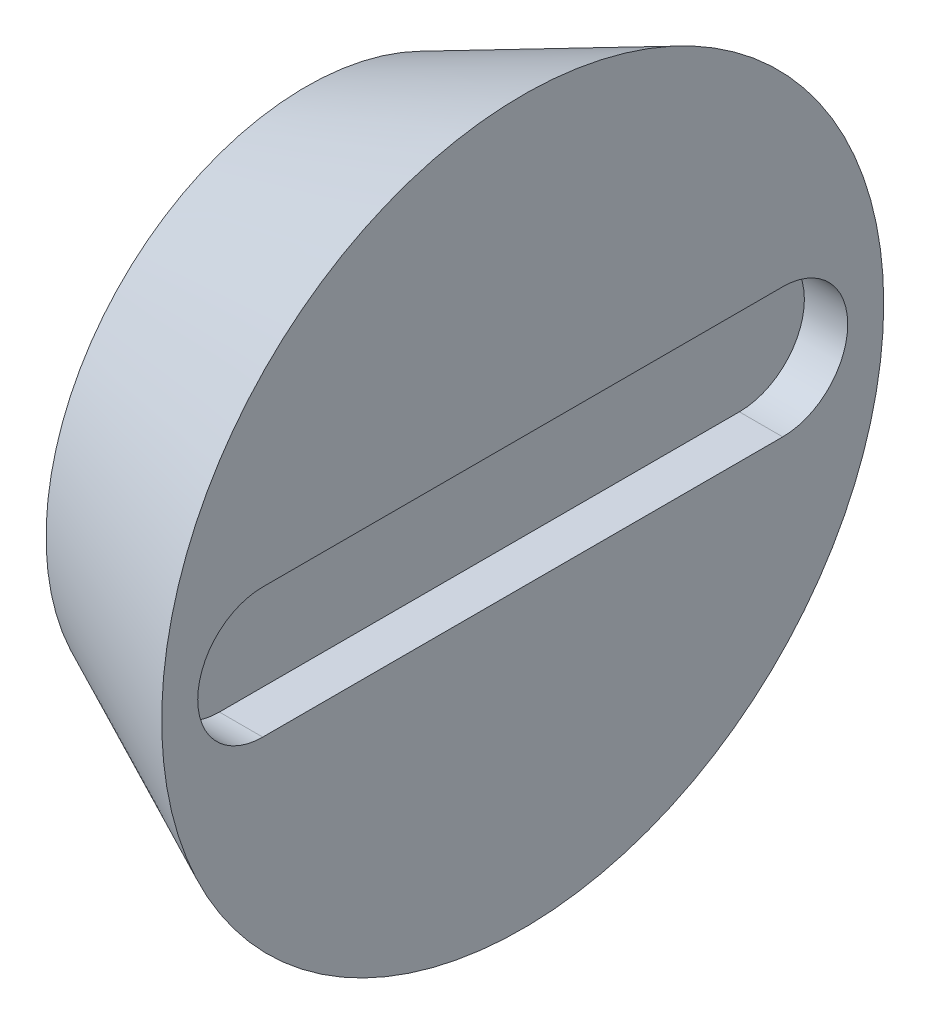
from build123d import *

# Parameters (mm, degrees)
SKETCH1_R           = 30
BOSS_EXTRUDE1_DEPTH = 25
BOSS_EXTRUDE1_DRAFT = -25
CUT_EXTRUDE1_DEPTH  = 5


with BuildPart() as part:
    # Sketch1 → Boss-Extrude1 (with draft: the straight prism first)
    with BuildSketch(Plane(origin=(0, 0, 0), x_dir=(0, 0, -1), z_dir=(1, 0, 0))):
        Circle(SKETCH1_R)
    extrude(amount=BOSS_EXTRUDE1_DEPTH)
    # Boss-Extrude1: the draft: its side faces are tilted about the plane it starts from
    boss_extrude1_sides = [part.faces().sort_by_distance(p)[0] for p in [
        (12.5, 0, 30),
    ]]
    draft(boss_extrude1_sides, Plane(origin=(0, 0, 0), x_dir=(0, 0, -1), z_dir=(1, 0, 0)), BOSS_EXTRUDE1_DRAFT)

    # Sketch2 → Cut-Extrude1 (cut)
    with BuildSketch(Plane(origin=(25, 0, 0), x_dir=(0, 0, -1), z_dir=(1, 0, 0))):
        with BuildLine():
            Line((-30, 7.5), (30, 7.5))
            ThreePointArc((30, 7.5), (37.5, 0), (30, -7.5))
            Line((30, -7.5), (-30, -7.5))
            ThreePointArc((-30, -7.5), (-37.5, 0), (-30, 7.5))
        make_face()
    extrude(amount=-CUT_EXTRUDE1_DEPTH, mode=Mode.SUBTRACT)


solid = part.part
